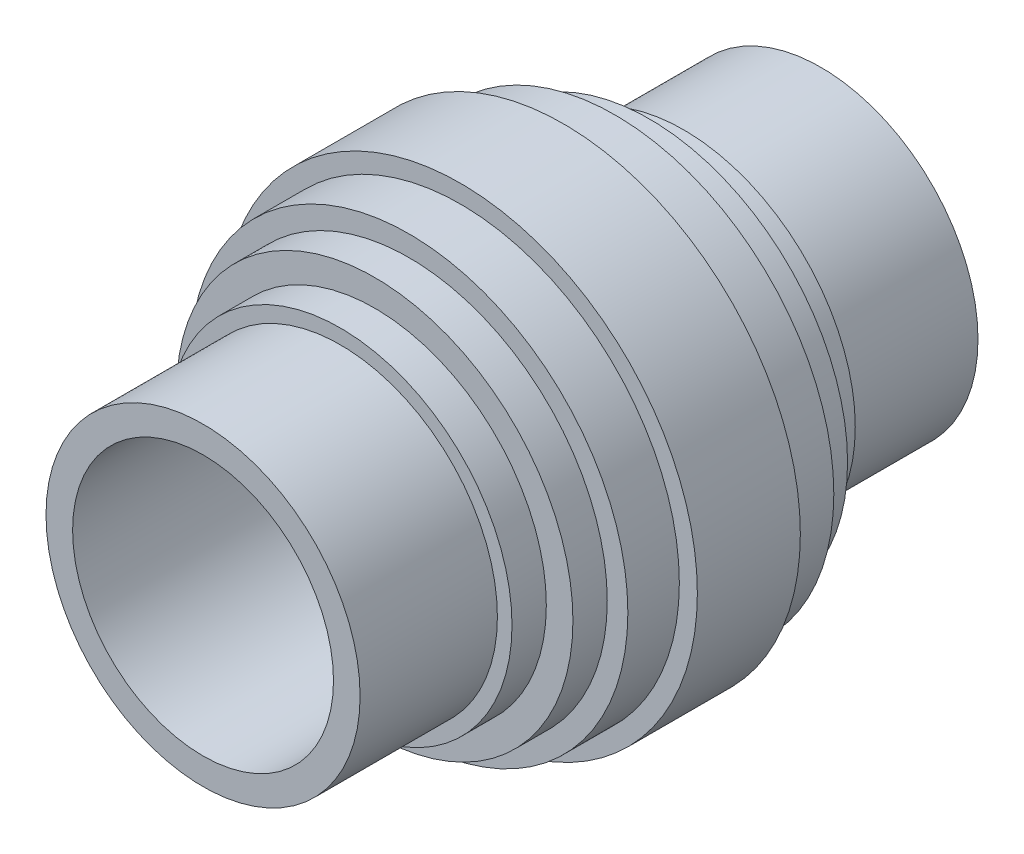
from build123d import *

# Parameters (mm, degrees)
F_01_START                                     = -3.6
S01_BALL_AND_MISALIGNMENT_SPACER_LAND_R        = 1.83
S01_BALL_AND_MISALIGNMENT_SPACER_LAND_R_2      = 1.52
F_01_BALL_AND_MISALIGNMENT_SPACER_LAND_1_DEPTH = 1.6
F_02_START                                     = -2
S02_BALL_AND_MISALIGNMENT_SPACER_LAND_R        = 2
S02_BALL_AND_MISALIGNMENT_SPACER_LAND_R_2      = 1.52
F_02_BALL_AND_MISALIGNMENT_SPACER_LAND_2_DEPTH = 0.4
F_03_START                                     = -1.6
S03_BALL_AND_MISALIGNMENT_SPACER_LAND_R        = 2.31
S03_BALL_AND_MISALIGNMENT_SPACER_LAND_R_2      = 1.52
F_03_BALL_AND_MISALIGNMENT_SPACER_LAND_3_DEPTH = 0.4
F_04_START                                     = -1.2
S04_BALL_AND_MISALIGNMENT_SPACER_LAND_R        = 2.55
S04_BALL_AND_MISALIGNMENT_SPACER_LAND_R_2      = 1.52
F_04_BALL_AND_MISALIGNMENT_SPACER_LAND_4_DEPTH = 0.6
F_05_START                                     = -0.6
S05_BALL_AND_MISALIGNMENT_SPACER_LAND_R        = 2.76
S05_BALL_AND_MISALIGNMENT_SPACER_LAND_R_2      = 1.52
F_05_BALL_AND_MISALIGNMENT_SPACER_LAND_5_DEPTH = 1.2
F_06_START                                     = 0.6
S06_BALL_AND_MISALIGNMENT_SPACER_LAND_R        = 2.55
S06_BALL_AND_MISALIGNMENT_SPACER_LAND_R_2      = 1.52
F_06_BALL_AND_MISALIGNMENT_SPACER_LAND_6_DEPTH = 0.6
F_07_START                                     = 1.2
S07_BALL_AND_MISALIGNMENT_SPACER_LAND_R        = 2.31
S07_BALL_AND_MISALIGNMENT_SPACER_LAND_R_2      = 1.52
F_07_BALL_AND_MISALIGNMENT_SPACER_LAND_7_DEPTH = 0.4
F_08_START                                     = 1.6
S08_BALL_AND_MISALIGNMENT_SPACER_LAND_R        = 2
S08_BALL_AND_MISALIGNMENT_SPACER_LAND_R_2      = 1.52
F_08_BALL_AND_MISALIGNMENT_SPACER_LAND_8_DEPTH = 0.4
F_09_START                                     = 2
S09_BALL_AND_MISALIGNMENT_SPACER_LAND_R        = 1.83
S09_BALL_AND_MISALIGNMENT_SPACER_LAND_R_2      = 1.52
F_09_BALL_AND_MISALIGNMENT_SPACER_LAND_9_DEPTH = 1.6


with BuildPart() as part:
    # S01 - Ball and misalignment spacer land 1 → 01 - Ball and misalignment spacer land 1 (new body)
    with BuildSketch(Plane.XY.offset(F_01_START)):
        Circle(S01_BALL_AND_MISALIGNMENT_SPACER_LAND_R)
        Circle(S01_BALL_AND_MISALIGNMENT_SPACER_LAND_R_2, mode=Mode.SUBTRACT)
    extrude(amount=F_01_BALL_AND_MISALIGNMENT_SPACER_LAND_1_DEPTH)

    # S02 - Ball and misalignment spacer land 2 → 02 - Ball and misalignment spacer land 2 (add)
    with BuildSketch(Plane.XY.offset(F_02_START)):
        Circle(S02_BALL_AND_MISALIGNMENT_SPACER_LAND_R)
        Circle(S02_BALL_AND_MISALIGNMENT_SPACER_LAND_R_2, mode=Mode.SUBTRACT)
    extrude(amount=F_02_BALL_AND_MISALIGNMENT_SPACER_LAND_2_DEPTH)

    # S03 - Ball and misalignment spacer land 3 → 03 - Ball and misalignment spacer land 3 (add)
    with BuildSketch(Plane.XY.offset(F_03_START)):
        Circle(S03_BALL_AND_MISALIGNMENT_SPACER_LAND_R)
        Circle(S03_BALL_AND_MISALIGNMENT_SPACER_LAND_R_2, mode=Mode.SUBTRACT)
    extrude(amount=F_03_BALL_AND_MISALIGNMENT_SPACER_LAND_3_DEPTH)

    # S04 - Ball and misalignment spacer land 4 → 04 - Ball and misalignment spacer land 4 (add)
    with BuildSketch(Plane.XY.offset(F_04_START)):
        Circle(S04_BALL_AND_MISALIGNMENT_SPACER_LAND_R)
        Circle(S04_BALL_AND_MISALIGNMENT_SPACER_LAND_R_2, mode=Mode.SUBTRACT)
    extrude(amount=F_04_BALL_AND_MISALIGNMENT_SPACER_LAND_4_DEPTH)

    # S05 - Ball and misalignment spacer land 5 → 05 - Ball and misalignment spacer land 5 (add)
    with BuildSketch(Plane.XY.offset(F_05_START)):
        Circle(S05_BALL_AND_MISALIGNMENT_SPACER_LAND_R)
        Circle(S05_BALL_AND_MISALIGNMENT_SPACER_LAND_R_2, mode=Mode.SUBTRACT)
    extrude(amount=F_05_BALL_AND_MISALIGNMENT_SPACER_LAND_5_DEPTH)

    # S06 - Ball and misalignment spacer land 6 → 06 - Ball and misalignment spacer land 6 (add)
    with BuildSketch(Plane.XY.offset(F_06_START)):
        Circle(S06_BALL_AND_MISALIGNMENT_SPACER_LAND_R)
        Circle(S06_BALL_AND_MISALIGNMENT_SPACER_LAND_R_2, mode=Mode.SUBTRACT)
    extrude(amount=F_06_BALL_AND_MISALIGNMENT_SPACER_LAND_6_DEPTH)

    # S07 - Ball and misalignment spacer land 7 → 07 - Ball and misalignment spacer land 7 (add)
    with BuildSketch(Plane.XY.offset(F_07_START)):
        Circle(S07_BALL_AND_MISALIGNMENT_SPACER_LAND_R)
        Circle(S07_BALL_AND_MISALIGNMENT_SPACER_LAND_R_2, mode=Mode.SUBTRACT)
    extrude(amount=F_07_BALL_AND_MISALIGNMENT_SPACER_LAND_7_DEPTH)

    # S08 - Ball and misalignment spacer land 8 → 08 - Ball and misalignment spacer land 8 (add)
    with BuildSketch(Plane.XY.offset(F_08_START)):
        Circle(S08_BALL_AND_MISALIGNMENT_SPACER_LAND_R)
        Circle(S08_BALL_AND_MISALIGNMENT_SPACER_LAND_R_2, mode=Mode.SUBTRACT)
    extrude(amount=F_08_BALL_AND_MISALIGNMENT_SPACER_LAND_8_DEPTH)

    # S09 - Ball and misalignment spacer land 9 → 09 - Ball and misalignment spacer land 9 (add)
    with BuildSketch(Plane.XY.offset(F_09_START)):
        Circle(S09_BALL_AND_MISALIGNMENT_SPACER_LAND_R)
        Circle(S09_BALL_AND_MISALIGNMENT_SPACER_LAND_R_2, mode=Mode.SUBTRACT)
    extrude(amount=F_09_BALL_AND_MISALIGNMENT_SPACER_LAND_9_DEPTH)


solid = part.part
